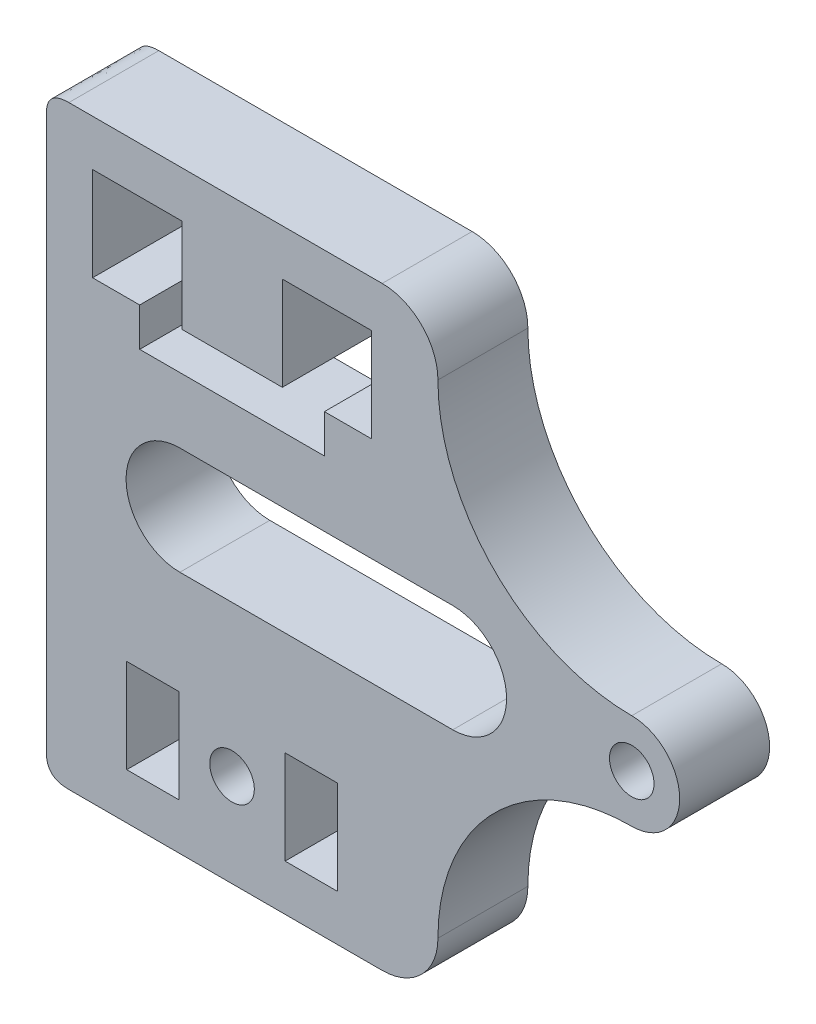
from build123d import *

# Parameters (mm, degrees)
SKETCH1_R           = 1.45
SKETCH1_W           = 3.400011
SKETCH1_H           = 6.1
BOSS_EXTRUDE2_DEPTH = 5.85
SKETCH2_R           = 1.25
CUT_EXTRUDE1_DEPTH  = 1


with BuildPart() as part:
    # Sketch1 → Boss-Extrude2 (new body)
    with BuildSketch(Plane.XY):
        with BuildLine():
            Line((388.946531589, 563.988903138), (409.324633118, 563.988903138))
            ThreePointArc((409.324633118, 563.988903138), (411.889147311, 562.926646578), (412.95140387, 560.362132386))
            ThreePointArc((412.95140387, 560.362132386), (416.644097047, 551.447182437), (425.559046996, 547.75448926))
            ThreePointArc((425.559046996, 547.75448926), (428.674633118, 544.638903138), (425.559046996, 541.523317015))
            ThreePointArc((425.559046996, 541.523317015), (416.644097047, 537.830623838), (412.95140387, 528.915673889))
            ThreePointArc((412.95140387, 528.915673889), (411.889147311, 526.351159697), (409.324633118, 525.288903138))
            Line((409.324633118, 525.288903138), (388.946531589, 525.288903138))
            add(Edge.make_bspline(
                [(387.48851407, 526.74542963), (387.408268294, 525.288903138), (388.946531589, 525.288903138)],
                knots=[0, 0, 0, 1, 1, 1], degree=2))
            Line((387.48851407, 526.74542963), (387.48851407, 562.532375923))
            add(Edge.make_bspline(
                [(387.48851407, 562.532375923), (387.408267487, 563.988903138), (388.946531589, 563.988903138)],
                knots=[0, 0, 0, 1, 1, 1], degree=2))
        make_face()
        with Locations((425.559046996, 544.638903138)):
            Circle(SKETCH1_R, mode=Mode.SUBTRACT)
        with Locations((399.559046996, 531.338903138)):
            Circle(SKETCH1_R, mode=Mode.SUBTRACT)
        Polygon((405.566920996, 552.388903138), (405.566920996, 554.888903138), (408.629579922, 554.888903138), (408.629579922, 560.988903138), (402.829579922, 560.988903138), (402.829579922, 554.888903138), (396.28851407, 554.888903138), (396.28851407, 560.988903138), (390.48851407, 560.988903138), (390.48851407, 554.888903138), (393.551172996, 554.888903138), (393.551172996, 552.388903138), align=None, mode=Mode.SUBTRACT)
        with Locations((394.409041496, 531.338903138)):
            Rectangle(SKETCH1_W, SKETCH1_H, mode=Mode.SUBTRACT)
        with Locations((404.709052496, 531.338903138)):
            Rectangle(SKETCH1_W, SKETCH1_H, mode=Mode.SUBTRACT)
        with BuildLine():
            Line((396.165690223, 548.138903138), (413.915690223, 548.138903138))
            ThreePointArc((413.915690223, 548.138903138), (417.415690223, 544.638903138), (413.915690223, 541.138903138))
            Line((413.915690223, 541.138903138), (396.165690223, 541.138903138))
            ThreePointArc((396.165690223, 541.138903138), (392.665690223, 544.638903138), (396.165690223, 548.138903138))
        make_face(mode=Mode.SUBTRACT)
    extrude(amount=BOSS_EXTRUDE2_DEPTH)

    # Sketch2 → Cut-Extrude1 (cut)
    with BuildSketch(Plane.XY):
        with Locations((409.659057996, 531.338903138)):
            Circle(SKETCH2_R)
    extrude(amount=CUT_EXTRUDE1_DEPTH, mode=Mode.SUBTRACT)


solid = part.part
